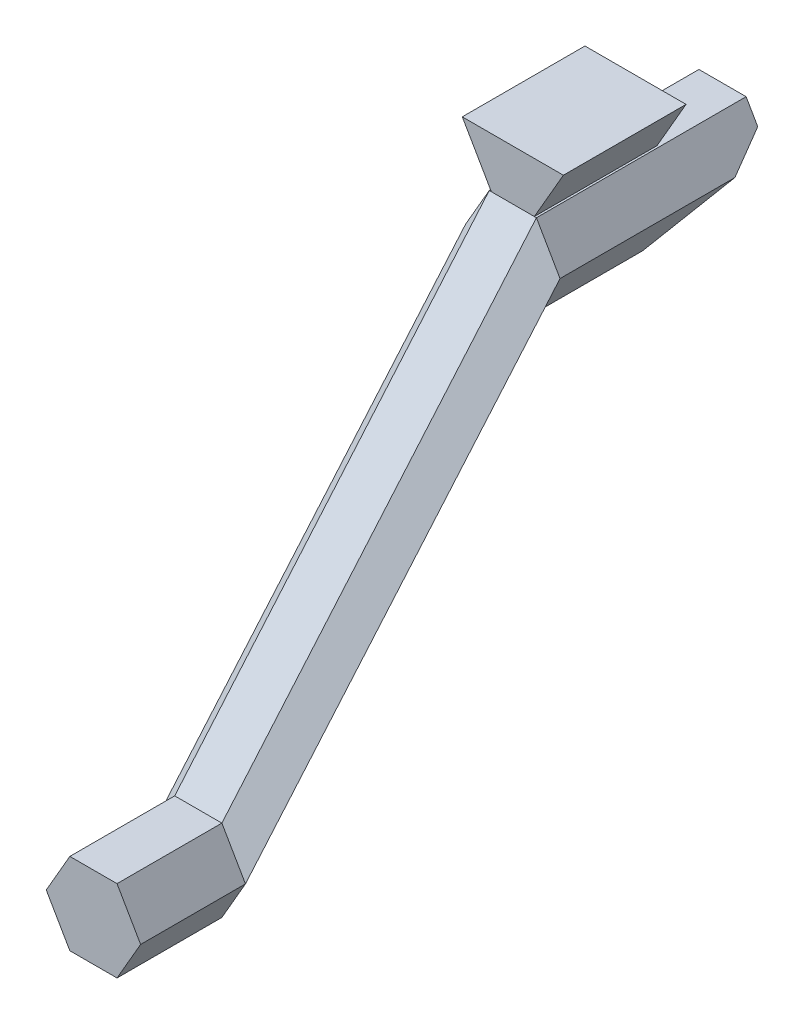
from build123d import *

# Parameters (mm, degrees)
BOSS_EXTRUDE1_DEPTH = 25.4
BOSS_EXTRUDE2_DEPTH = 12.7
BOSS_EXTRUDE3_DEPTH = 25.4
CHAMFER1_SIZE       = 7.46
CHAMFER1_SIZE2      = 12.54
CUT_EXTRUDE1_DEPTH  = 10.16
CUT_EXTRUDE3_DEPTH  = 83.717848151
CHAMFER7_SIZE       = 0.381


with BuildPart() as part:
    # Sketch1 → Boss-Extrude1 (new body)
    with BuildSketch(Plane.XY):
        Polygon((5.715, 0), (2.8575, 4.949335183), (-2.8575, 4.949335183), (-5.715, 0), (-2.8575, -4.949335183), (2.8575, -4.949335183), align=None)
    extrude(amount=BOSS_EXTRUDE1_DEPTH)



with BuildPart() as body_2:
    # Sketch2 → Boss-Extrude2 (new body)
    with BuildSketch(Plane.XY.offset(63.5)):
        Polygon((-2.8575, -49.399335183), (2.8575, -49.399335183), (5.715, -44.45), (2.8575, -39.500664817), (-2.8575, -39.500664817), (-5.715, -44.45), align=None)
    extrude(amount=BOSS_EXTRUDE2_DEPTH)


with BuildPart() as part_1:
    add(part.part)

    add(body_2.part)  # loft1 joins it to this body
    # loft from a face of the part (loft1)
    loft([part_1.faces().sort_by_distance((0, 0, 25.4))[0], part_1.faces().sort_by_distance((0, -44.45, 63.5))[0]])

    # Sketch4 → Boss-Extrude3 (add)
    with BuildSketch(Plane(origin=(0, 0, 0), x_dir=(-1, 0, 0), z_dir=(0, 0, -1))):
        Polygon((2.8575, 4.949335183), (6.377027241, 11.045335183), (-6.377027241, 11.045335183), (-2.8575, 4.949335183), align=None)
    extrude(amount=-BOSS_EXTRUDE3_DEPTH)

    # Chamfer1
    chamfer1_edges = [part_1.edges().sort_by_distance(p)[0] for p in [
        (0, -4.949335183, 0),
    ]]
    chamfer1_side = [part_1.faces().sort_by_distance(p)[0] for p in [
        (0, 3.343943544, 0),
    ]]
    chamfer(chamfer1_edges, length=CHAMFER1_SIZE, length2=CHAMFER1_SIZE2, reference=chamfer1_side[0])

    # Sketch8 → Cut-Extrude1 (cut)
    with BuildSketch(Plane(origin=(0, 0, 0), x_dir=(-1, 0, 0), z_dir=(0, 0, -1))):
        Polygon((-6.377027241, 11.045335183), (6.377027241, 11.045335183), (2.8575, 4.949335183), (-2.8575, 4.949335183), align=None)
    extrude(amount=-CUT_EXTRUDE1_DEPTH, mode=Mode.SUBTRACT)

    # Sketch9 → Cut-Extrude3 (cut, through all)
    with BuildSketch(Plane(origin=(0, 0, 10.16), x_dir=(-1, 0, 0), z_dir=(0, 0, -1))):
        Polygon((6.123027241, 11.045335183), (2.6035, 4.949335183), (2.8575, 4.949335183), (6.377027241, 11.045335183), align=None)
        Polygon((-2.6035, 4.949335183), (-6.123027241, 11.045335183), (-6.377027241, 11.045335183), (-2.8575, 4.949335183), align=None)
    extrude(amount=-CUT_EXTRUDE3_DEPTH, mode=Mode.SUBTRACT)

    # Chamfer7
    chamfer7_edges = [part_1.edges().sort_by_distance(p)[0] for p in [
        (4.36326362, 7.997335183, 10.16),
        (-4.36326362, 7.997335183, 10.16),
        (0, 11.045335183, 10.16),
    ]]
    chamfer(chamfer7_edges, length=CHAMFER7_SIZE)


solid = part_1.part
